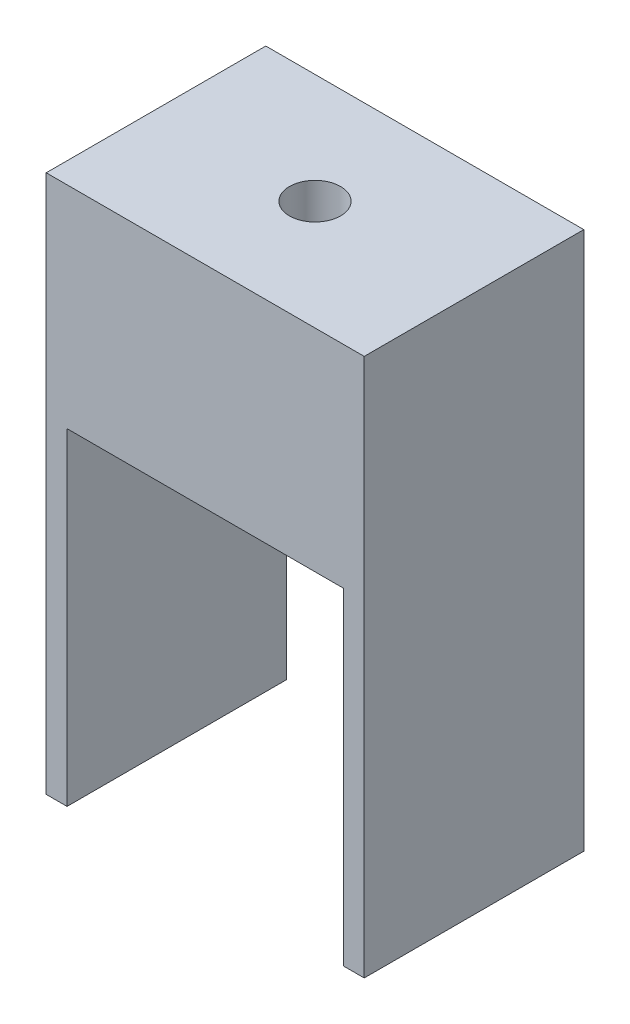
from build123d import *

# Parameters (mm, degrees)
SKETCH1_W           = 45.78
SKETCH1_H           = 31.61
BOSS_EXTRUDE2_DEPTH = 77.5
SKETCH2_R           = 3.675
CUT_EXTRUDE1_DEPTH  = 25.4
SKETCH3_W           = 39.78
SKETCH3_H           = 47.1
CUT_EXTRUDE3_DEPTH  = 87.772081916


with BuildPart() as part:
    # Sketch1 → Boss-Extrude2 (new body)
    with BuildSketch(Plane(origin=(0, 0, 0), x_dir=(1, 0, 0), z_dir=(0, 1, 0))):
        Rectangle(SKETCH1_W, SKETCH1_H)
    extrude(amount=BOSS_EXTRUDE2_DEPTH)

    # Sketch2 → Cut-Extrude1 (cut)
    with BuildSketch(Plane(origin=(0, 77.5, 0), x_dir=(1, 0, 0), z_dir=(0, 1, 0))):
        with Locations(Location((0, 0, 0), (0, 0, 270))):
            Circle(SKETCH2_R)
    extrude(amount=-CUT_EXTRUDE1_DEPTH, mode=Mode.SUBTRACT)

    # Sketch3 → Cut-Extrude3 (cut, through all)
    with BuildSketch(Plane(origin=(0, 0, -15.805), x_dir=(-1, 0, 0), z_dir=(0, 0, -1))):
        with Locations((0, 23.55)):
            Rectangle(SKETCH3_W, SKETCH3_H)
    extrude(amount=-CUT_EXTRUDE3_DEPTH, mode=Mode.SUBTRACT)


solid = part.part
